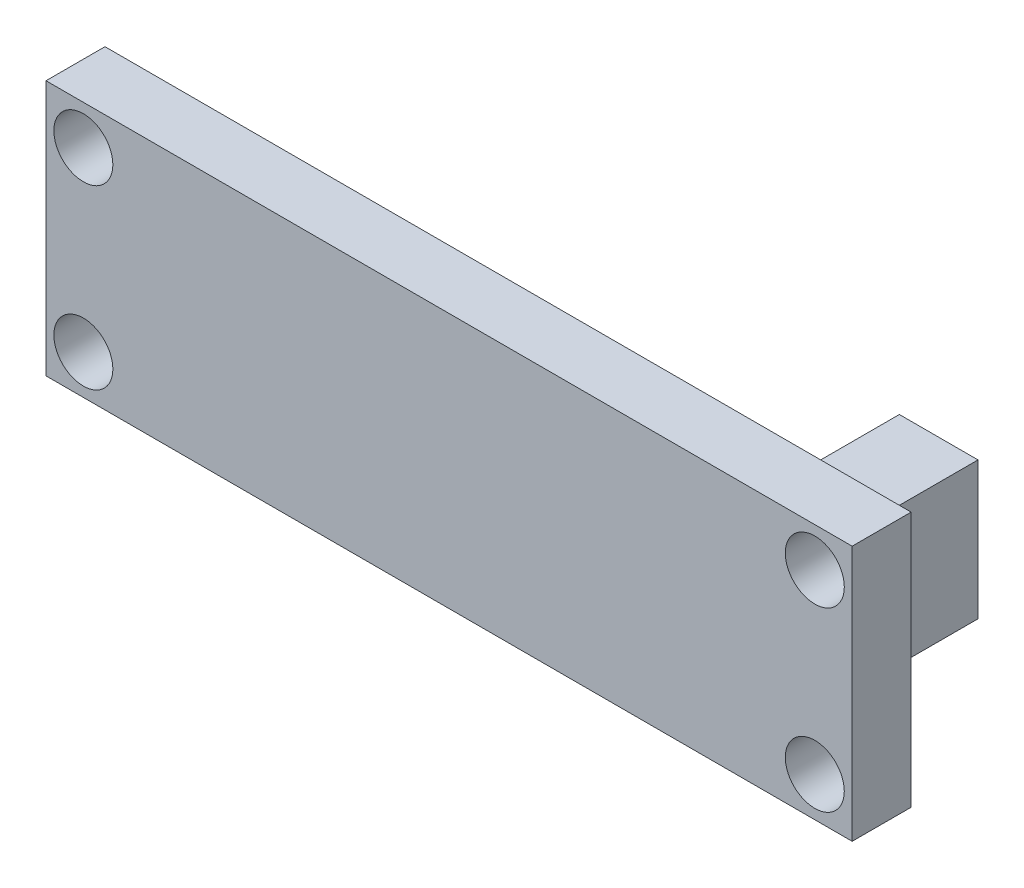
from build123d import *

# Parameters (mm, degrees)
CROQUIS1_W              = 41
CROQUIS1_H              = 13
SALIENTE_EXTRUIR1_DEPTH = 3
CROQUIS2_R              = 1.5
CORTAR_EXTRUIR1_DEPTH   = 44.116122275
CROQUIS3_W              = 4
CROQUIS3_H              = 7
SALIENTE_EXTRUIR2_DEPTH = 7


with BuildPart() as part:
    # Croquis1 → Saliente-Extruir1 (new body)
    with BuildSketch(Plane.XY):
        with Locations((-20.5, 6.5)):
            Rectangle(CROQUIS1_W, CROQUIS1_H)
    extrude(amount=SALIENTE_EXTRUIR1_DEPTH)

    # Croquis2 → Cortar-Extruir1 (cut, through all)
    with BuildSketch(Plane.XY.offset(3)):
        with Locations((-1.9, 11)):
            Circle(CROQUIS2_R)
        with Locations((-1.9, 2)):
            Circle(CROQUIS2_R)
        with Locations((-39.1, 11)):
            Circle(CROQUIS2_R)
        with Locations((-39.1, 2)):
            Circle(CROQUIS2_R)
    extrude(amount=-CORTAR_EXTRUIR1_DEPTH, mode=Mode.SUBTRACT)

    # Croquis3 → Saliente-Extruir2 (add)
    with BuildSketch(Plane(origin=(0, 0, 0), x_dir=(-1, 0, 0), z_dir=(0, 0, -1))):
        with Locations((5.6, 6.5)):
            Rectangle(CROQUIS3_W, CROQUIS3_H)
    extrude(amount=SALIENTE_EXTRUIR2_DEPTH)


solid = part.part
